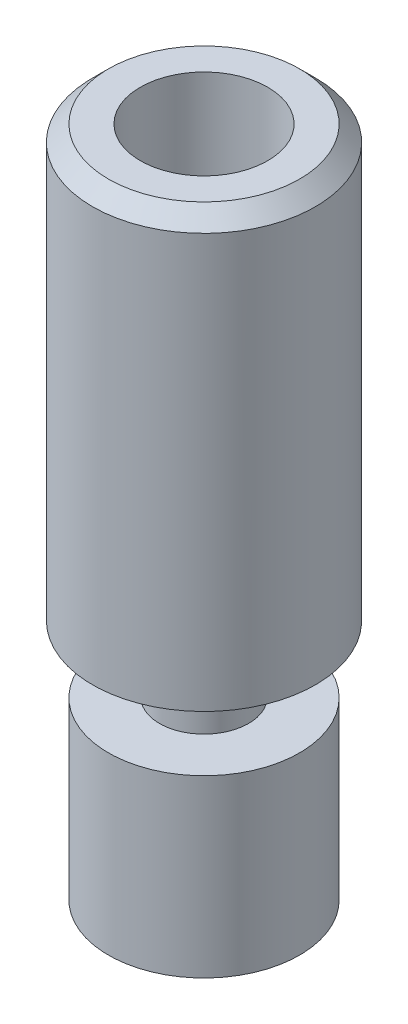
from build123d import *

# Parameters (mm, degrees)
CHAMFER1_SIZE = 0.5


with BuildPart() as part:
    # Sketch1 → Revolve1 (revolve)
    with BuildSketch(Plane.XY, mode=Mode.PRIVATE) as revolve1_sk:
        Polygon((1, -10.55), (3, -10.55), (3, -5.05), (1.4, -5.05), (1.4, -2.95), (3.5, -2.95), (3.5, 10.55), (2, 10.55), (2, 6.55), (1, 5.972649731), align=None)
    revolve(revolve1_sk.sketch.rotate(Axis((0, -10.55, 0), (0, 1, 0)), 90), axis=Axis((0, -10.55, 0), (0, 1, 0)))

    # Chamfer1
    chamfer1_edges = [part.edges().sort_by_distance(p)[0] for p in [
        (0, 10.55, 3.5),
    ]]
    chamfer(chamfer1_edges, length=CHAMFER1_SIZE)


solid = part.part
